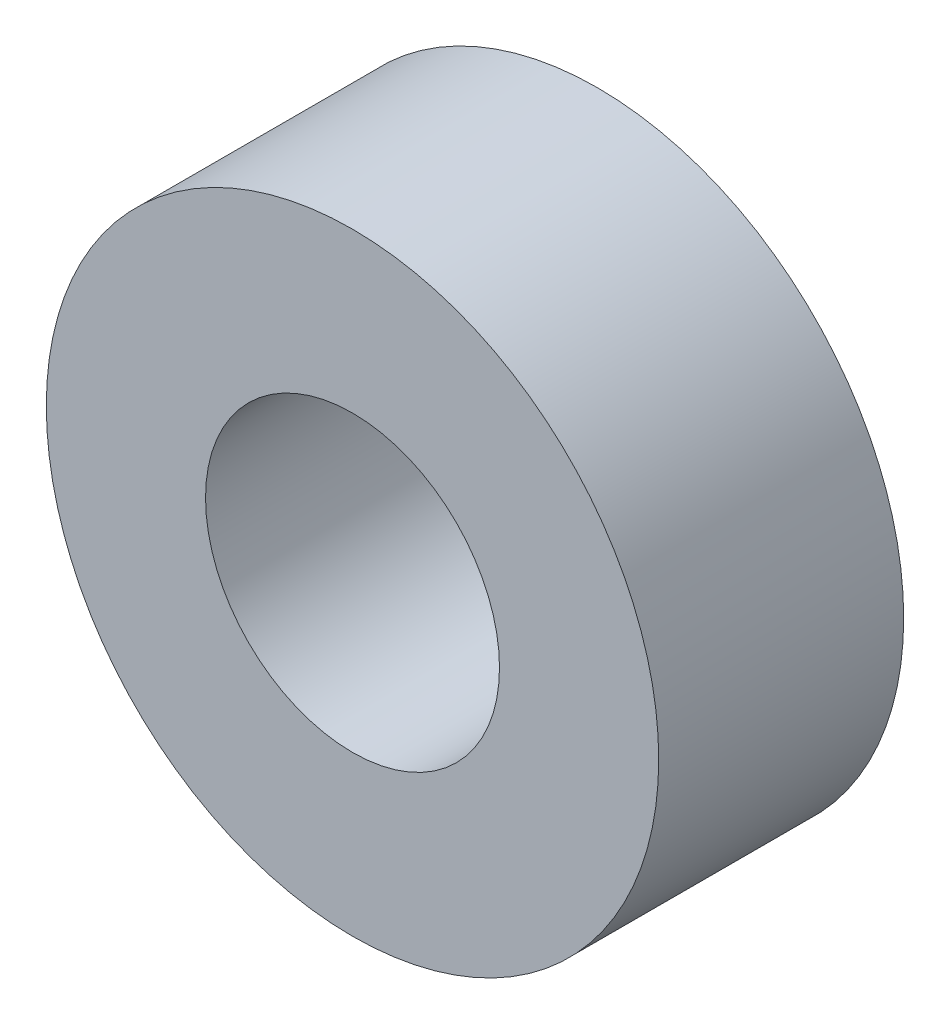
from build123d import *

# Parameters (mm, degrees)
SKETCH1_R           = 6.25
SKETCH1_R_2         = 3
BOSS_EXTRUDE1_DEPTH = 5


with BuildPart() as part:
    # Sketch1 → Boss-Extrude1 (new body)
    with BuildSketch(Plane.XY):
        Circle(SKETCH1_R)
        Circle(SKETCH1_R_2, mode=Mode.SUBTRACT)
    extrude(amount=BOSS_EXTRUDE1_DEPTH)


solid = part.part
